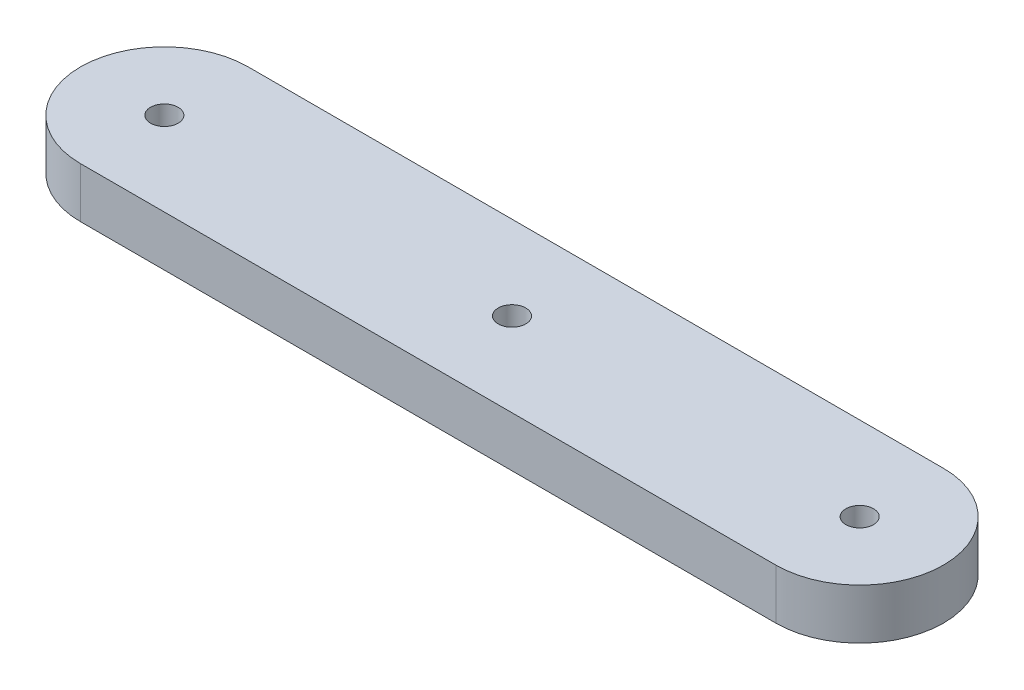
from build123d import *

# Parameters (mm, degrees)
SKETCH1_R           = 1.65
BOSS_EXTRUDE1_DEPTH = 6


with BuildPart() as part:
    # Sketch1 → Boss-Extrude1 (new body)
    with BuildSketch(Plane(origin=(0, 0, 0), x_dir=(1, 0, 0), z_dir=(0, 1, 0))):
        with BuildLine():
            Line((-41.48, 10), (41.48, 10))
            ThreePointArc((41.48, 10), (51.48, 0), (41.48, -10))
            Line((41.48, -10), (-41.48, -10))
            ThreePointArc((-41.48, -10), (-51.48, 0), (-41.48, 10))
        make_face()
        with Locations(Location((-41.48, 0, 0), (0, 0, 270))):
            Circle(SKETCH1_R, mode=Mode.SUBTRACT)
        with Locations(Location((41.48, 0, 0), (0, 0, 270))):
            Circle(SKETCH1_R, mode=Mode.SUBTRACT)
        with Locations(Location((0, 0, 0), (0, 0, 270))):
            Circle(SKETCH1_R, mode=Mode.SUBTRACT)
    extrude(amount=BOSS_EXTRUDE1_DEPTH)


solid = part.part
